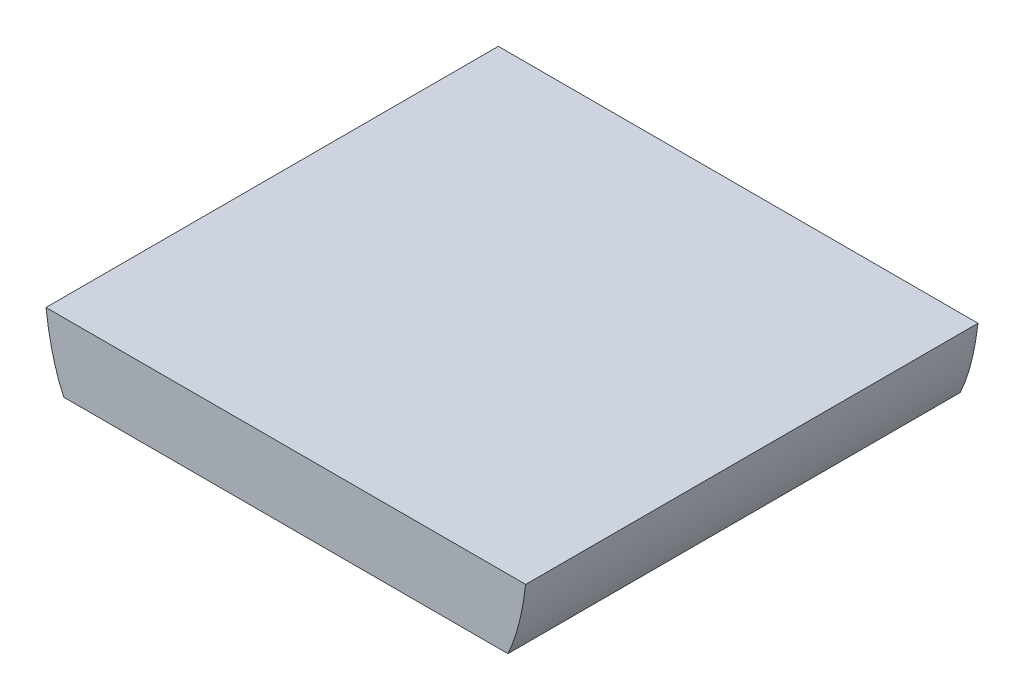
from build123d import *

# Parameters (mm, degrees)
BOSS_EXTRUDE1_DEPTH      = 330.2
BOSS_EXTRUDE1_DEPTH_BACK = 330.2
SPLIT1_SURFACE_1_BACK    = 989.051
SPLIT1_SURFACE_1_DEPTH   = 1978.102


with BuildPart() as part:
    # Sketch1 → Boss-Extrude1 (new, two sides: drawn at the far end of the back side and taken through both)
    with BuildSketch(Plane.XY.offset(-BOSS_EXTRUDE1_DEPTH_BACK)):
        with BuildLine():
            Line((-350.176916026, 222.758), (0, 222.758))
            Line((0, 222.758), (350.176916026, 222.758))
            add(Edge.make_bspline(
                [(350.176916026, 222.758), (323.602122165, 0), (0, 0)],
                knots=[0, 0, 0, 1, 1, 1], degree=2, weights=[1, 1.328097491, 1]))
            add(Edge.make_bspline(
                [(-350.176916026, 222.758), (-323.602122165, 0), (0, 0)],
                knots=[0, 0, 0, 1, 1, 1], degree=2, weights=[1, 1.328097491, 1]))
        make_face()
    extrude(amount=BOSS_EXTRUDE1_DEPTH + BOSS_EXTRUDE1_DEPTH_BACK)

    # Split1: cut with a surface, the side it looks to stays
    # Split1 surface: a surface, the sketch's curves swept straight by 1978.102 mm
    with BuildLine(Plane.XY.offset(-SPLIT1_SURFACE_1_BACK), mode=Mode.PRIVATE) as split1_surface_1_path:
        Line((-363.688822472, 122.174), (403.145628683, 122.174))
    split1_surface_1 = Shell.extrude(split1_surface_1_path.wire(), (0 * SPLIT1_SURFACE_1_DEPTH, 0 * SPLIT1_SURFACE_1_DEPTH, 1 * SPLIT1_SURFACE_1_DEPTH))
    split(bisect_by=split1_surface_1, keep=Keep.TOP)


solid = part.part
